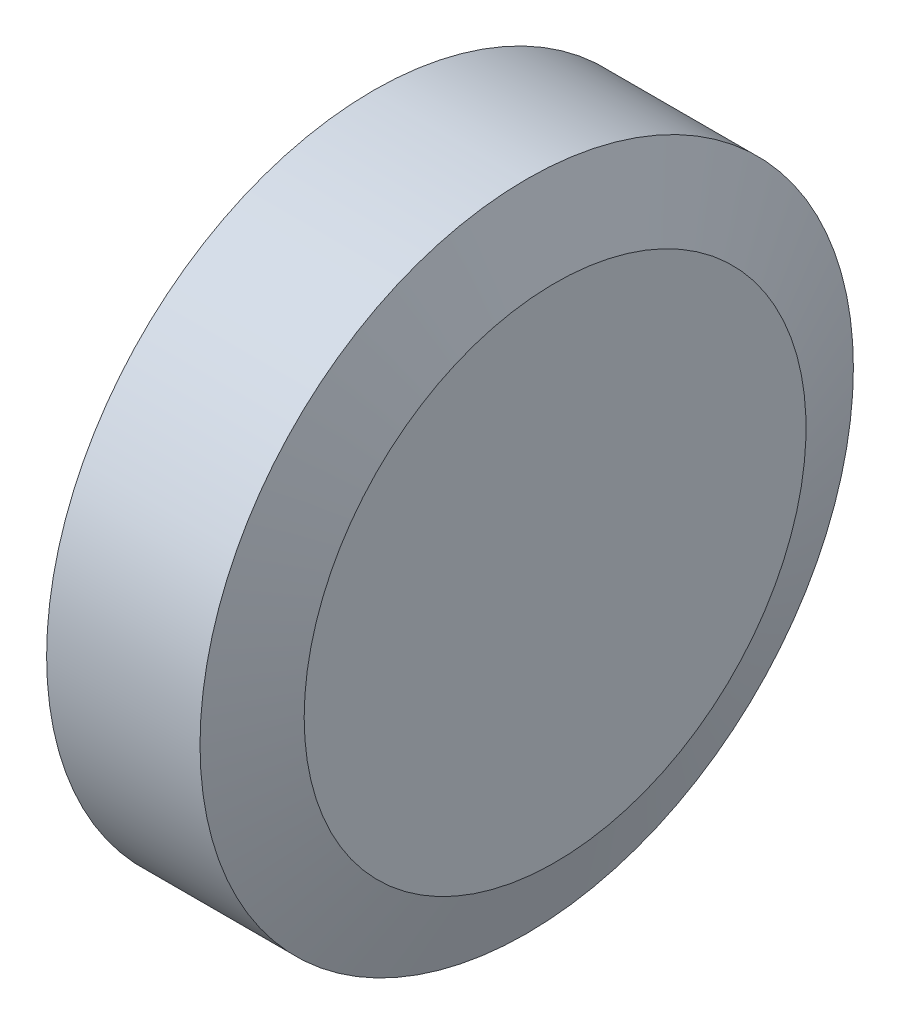
from build123d import *

# Parameters (mm, degrees)
SKETCH2_R           = 1.5
SKETCH2_R_2         = 20.25
SKETCH2_R_3         = 16
BOSS_EXTRUDE2_DEPTH = 3
SKETCH2_3_R         = 1.5
CUT_EXTRUDE1_DEPTH  = 3
FILLET1_R           = 1


with BuildPart() as part:
    # Sketch1 → Revolve1 (revolve)
    with BuildSketch(Plane.XY, mode=Mode.PRIVATE) as revolve1_sk:
        Polygon((0, 0), (0, 26.5), (-3, 34.5), (-19.2, 34.5), (-19.2, 20.25), (-25.5, 20.25), (-25.5, 16), (-26.5, 16), (-26.5, 0), align=None)
    revolve(revolve1_sk.sketch.rotate(Axis((-26.134704071, 0, 0), (1, 0, 0)), 90), axis=Axis((-26.134704071, 0, 0), (1, 0, 0)))


with BuildPart() as body_2:
    # Sketch2 → Boss-Extrude2 (new body)
    # profile 1 of 26: a face of its own
    with BuildSketch(Plane.ZY.offset(25.5)):
        with Locations((10.5, -18.186533479)):
            Circle(SKETCH2_R)
    # profile 2 of 26: a face of its own
    with BuildSketch(Plane.ZY.offset(25.5)):
        Circle(SKETCH2_R_2)
    # profile 3 of 26: a face of its own
    with BuildSketch(Plane.ZY.offset(25.5)):
        with Locations((10.5, -18.186533479)):
            Circle(SKETCH2_R)
    # profile 4 of 26: a face of its own
    with BuildSketch(Plane.ZY.offset(25.5)):
        Circle(SKETCH2_R_2)
    # profile 5 of 26: a face of its own
    with BuildSketch(Plane.ZY.offset(25.5)):
        with Locations((-10.5, -18.186533479)):
            Circle(SKETCH2_R)
    # profile 6 of 26: a face of its own
    with BuildSketch(Plane.ZY.offset(25.5)):
        Circle(SKETCH2_R_2)
    # profile 7 of 26: a face of its own
    with BuildSketch(Plane.ZY.offset(25.5)):
        with Locations((21, 0)):
            Circle(SKETCH2_R)
    # profile 8 of 26: a face of its own
    with BuildSketch(Plane.ZY.offset(25.5)):
        Circle(SKETCH2_R_2)
    # profile 9 of 26: a face of its own
    with BuildSketch(Plane.ZY.offset(25.5)):
        with Locations((21, 0)):
            Circle(SKETCH2_R)
    # profile 10 of 26: a face of its own
    with BuildSketch(Plane.ZY.offset(25.5)):
        Circle(SKETCH2_R_2)
    # profile 11 of 26: a face of its own
    with BuildSketch(Plane.ZY.offset(25.5)):
        with Locations((10.5, 18.186533479)):
            Circle(SKETCH2_R)
    # profile 12 of 26: a face of its own
    with BuildSketch(Plane.ZY.offset(25.5)):
        Circle(SKETCH2_R_2)
    # profile 13 of 26: a face of its own
    with BuildSketch(Plane.ZY.offset(25.5)):
        with Locations((10.5, 18.186533479)):
            Circle(SKETCH2_R)
    # profile 14 of 26: a face of its own
    with BuildSketch(Plane.ZY.offset(25.5)):
        Circle(SKETCH2_R_2)
    # profile 15 of 26: a face of its own
    with BuildSketch(Plane.ZY.offset(25.5)):
        with Locations((-10.5, 18.186533479)):
            Circle(SKETCH2_R)
    # profile 16 of 26: a face of its own
    with BuildSketch(Plane.ZY.offset(25.5)):
        Circle(SKETCH2_R_2)
    # profile 17 of 26: a face of its own
    with BuildSketch(Plane.ZY.offset(25.5)):
        with Locations((-10.5, 18.186533479)):
            Circle(SKETCH2_R)
    # profile 18 of 26: a face of its own
    with BuildSketch(Plane.ZY.offset(25.5)):
        Circle(SKETCH2_R_2)
    # profile 19 of 26: a face of its own
    with BuildSketch(Plane.ZY.offset(25.5)):
        with Locations((-21, 0)):
            Circle(SKETCH2_R)
    # profile 20 of 26: a face of its own
    with BuildSketch(Plane.ZY.offset(25.5)):
        with Locations((-10.5, -18.186533479)):
            Circle(SKETCH2_R)
    # profile 21 of 26: a face of its own
    with BuildSketch(Plane.ZY.offset(25.5)):
        with Locations((10.5, -18.186533479)):
            Circle(SKETCH2_R)
    # profile 22 of 26: a face of its own
    with BuildSketch(Plane.ZY.offset(25.5)):
        with Locations((21, 0)):
            Circle(SKETCH2_R)
    # profile 23 of 26: a face of its own
    with BuildSketch(Plane.ZY.offset(25.5)):
        with Locations((10.5, 18.186533479)):
            Circle(SKETCH2_R)
    # profile 24 of 26: a face of its own
    with BuildSketch(Plane.ZY.offset(25.5)):
        with Locations((-10.5, 18.186533479)):
            Circle(SKETCH2_R)
    # profile 25 of 26: a face of its own
    with BuildSketch(Plane.ZY.offset(25.5)):
        Circle(SKETCH2_R_2)
        Circle(SKETCH2_R_3, mode=Mode.SUBTRACT)
    # profile 26 of 26: a face of its own
    with BuildSketch(Plane.ZY.offset(25.5)):
        with BuildLine():
            ThreePointArc((-22.912878475, 2), (-23, 0), (-22.912878475, -2))
            Line((-22.912878475, -2), (-20.113179759, -2.35))
            ThreePointArc((-20.113179759, -2.35), (-17.537014427, -10.125), (-12.091749578, -16.243524622))
            Line((-12.091749578, -16.243524622), (-13.188490045, -18.843134833))
            ThreePointArc((-13.188490045, -18.843134833), (-11.5, -19.918584287), (-9.72438843, -20.843134833))
            Line((-9.72438843, -20.843134833), (-8.02143018, -18.593524622))
            ThreePointArc((-8.02143018, -18.593524622), (0, -20.25), (8.02143018, -18.593524622))
            Line((8.02143018, -18.593524622), (9.72438843, -20.843134833))
            ThreePointArc((9.72438843, -20.843134833), (11.5, -19.918584287), (13.188490045, -18.843134833))
            Line((13.188490045, -18.843134833), (12.091749578, -16.243524622))
            ThreePointArc((12.091749578, -16.243524622), (17.537014427, -10.125), (20.113179759, -2.35))
            Line((20.113179759, -2.35), (22.912878475, -2))
            ThreePointArc((22.912878475, -2), (23, 0), (22.912878475, 2))
            Line((22.912878475, 2), (20.113179759, 2.35))
            ThreePointArc((20.113179759, 2.35), (17.537014427, 10.125), (12.091749578, 16.243524622))
            Line((12.091749578, 16.243524622), (13.188490045, 18.843134833))
            ThreePointArc((13.188490045, 18.843134833), (11.5, 19.918584287), (9.72438843, 20.843134833))
            Line((9.72438843, 20.843134833), (8.02143018, 18.593524622))
            ThreePointArc((8.02143018, 18.593524622), (0, 20.25), (-8.02143018, 18.593524622))
            Line((-8.02143018, 18.593524622), (-9.72438843, 20.843134833))
            ThreePointArc((-9.72438843, 20.843134833), (-11.5, 19.918584287), (-13.188490045, 18.843134833))
            Line((-13.188490045, 18.843134833), (-12.091749578, 16.243524622))
            ThreePointArc((-12.091749578, 16.243524622), (-17.537014427, 10.125), (-20.113179759, 2.35))
            Line((-20.113179759, 2.35), (-22.912878475, 2))
        make_face()
    extrude(amount=-BOSS_EXTRUDE2_DEPTH)


with BuildPart() as cut_extrude1_tool:
    # Sketch2<3> → Cut-Extrude1 (new body)
    with BuildSketch(Plane.ZY.offset(25.5)):
        with Locations((-10.5, 18.186533479)):
            Circle(SKETCH2_3_R)
        with Locations((10.5, 18.186533479)):
            Circle(SKETCH2_3_R)
        with Locations((21, 0)):
            Circle(SKETCH2_3_R)
        with Locations((10.5, -18.186533479)):
            Circle(SKETCH2_3_R)
        with Locations((-10.5, -18.186533479)):
            Circle(SKETCH2_3_R)
        with Locations((-21, 0)):
            Circle(SKETCH2_3_R)
    extrude(amount=-CUT_EXTRUDE1_DEPTH)


with BuildPart() as part_1:
    add(part.part)

    # Cut-Extrude1: cut by cut_extrude1_tool
    add(cut_extrude1_tool.part, mode=Mode.SUBTRACT)


with BuildPart() as body_2_1:
    add(body_2.part)

    # Cut-Extrude1: cut by cut_extrude1_tool
    add(cut_extrude1_tool.part, mode=Mode.SUBTRACT)

    # Fillet1
    fillet1_edges = [body_2_1.edges().sort_by_distance(p)[0] for p in [
        (-24, 18.843134833, -13.188490045),
        (-24, 20.843134833, -9.72438843),
        (-24, 20.843134833, 9.72438843),
        (-24, 18.843134833, 13.188490045),
        (-24, 2, 22.912878475),
        (-24, -2, 22.912878475),
        (-24, -18.843134833, 13.188490045),
        (-24, -20.843134833, 9.72438843),
        (-24, -20.843134833, -9.72438843),
        (-24, -18.843134833, -13.188490045),
        (-24, -2, -22.912878475),
        (-24, 2, -22.912878475),
    ]]
    fillet(fillet1_edges, radius=FILLET1_R)


solid = Compound([part_1.part, body_2_1.part])
